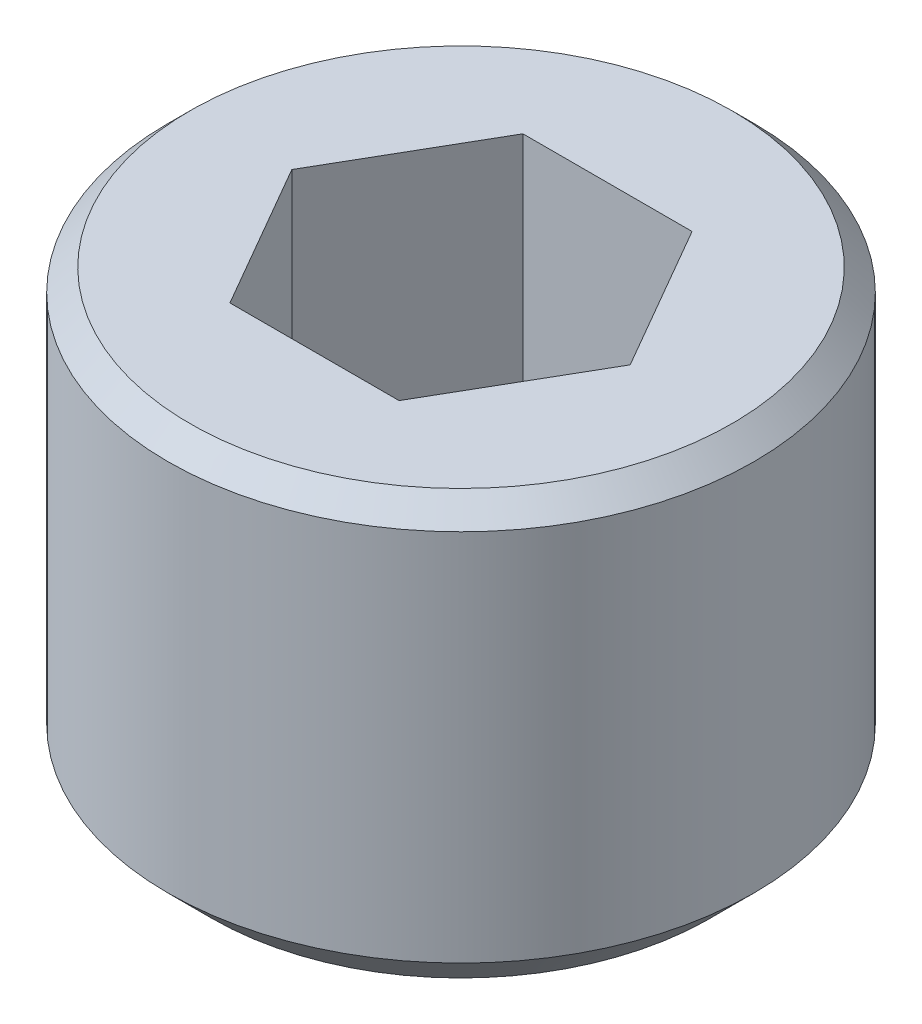
from build123d import *

# Parameters (mm, degrees)
CROQUIS1_W            = 2
CROQUIS1_H            = 3
CORTAR_EXTRUIR2_DEPTH = 2
CHAFL_N3_SIZE         = 0.3
CHAFL_N4_SIZE         = 0.15


with BuildPart() as part:
    # Croquis1 → Revolución1 (revolve)
    with BuildSketch(Plane.XY, mode=Mode.PRIVATE) as revoluci_n1_sk:
        with Locations((1, -1.5)):
            Rectangle(CROQUIS1_W, CROQUIS1_H)
    revolve(revoluci_n1_sk.sketch.rotate(Axis((0, 0, 0), (0, -1, 0)), 90), axis=Axis((0, 0, 0), (0, -1, 0)))

    # Croquis3 → Cortar-Extruir2 (cut)
    with BuildSketch(Plane(origin=(0, 0, 0), x_dir=(1, 0, 0), z_dir=(0, 1, 0))):
        Polygon((-0.577350269, 1), (-1.154700538, 0), (-0.577350269, -1), (0.577350269, -1), (1.154700538, 0), (0.577350269, 1), align=None)
    extrude(amount=-CORTAR_EXTRUIR2_DEPTH, mode=Mode.SUBTRACT)

    # Chaflán3
    chafl_n3_edges = [part.edges().sort_by_distance(p)[0] for p in [
        (0, -3, -2),
    ]]
    chamfer(chafl_n3_edges, length=CHAFL_N3_SIZE)

    # Chaflán4
    chafl_n4_edges = [part.edges().sort_by_distance(p)[0] for p in [
        (0, 0, -2),
    ]]
    chamfer(chafl_n4_edges, length=CHAFL_N4_SIZE)


solid = part.part
